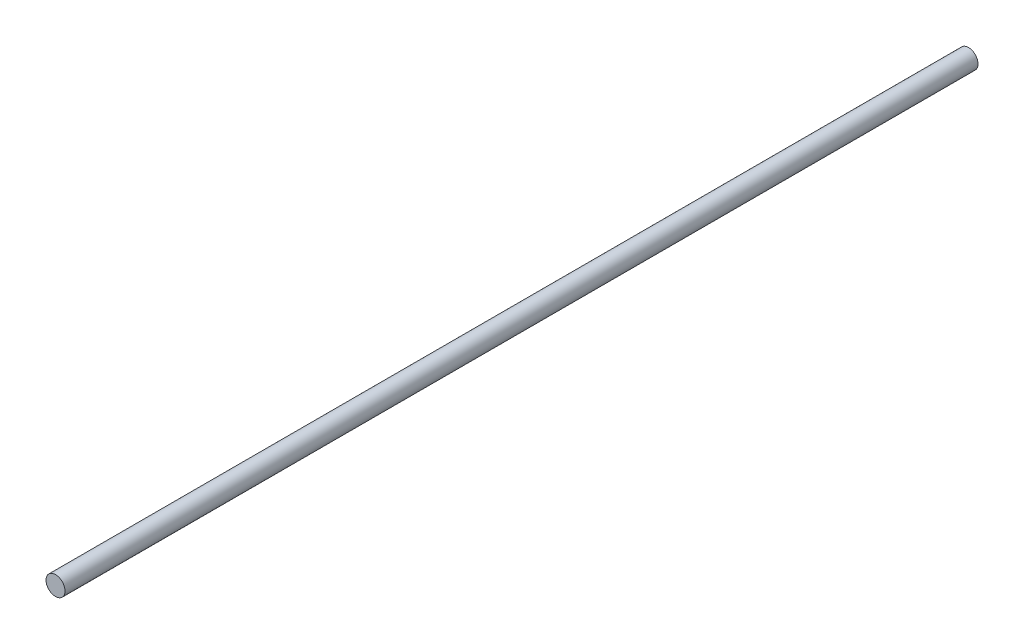
from build123d import *

# Parameters (mm, degrees)
SKETCH1_R           = 0.79375
BOSS_EXTRUDE1_DEPTH = 76.2


with BuildPart() as part:
    # Sketch1 → Boss-Extrude1 (new body)
    with BuildSketch(Plane.XY):
        with Locations(Location((0, 0, 0), (0, 0, 180))):
            Circle(SKETCH1_R)
    extrude(amount=BOSS_EXTRUDE1_DEPTH)


solid = part.part
